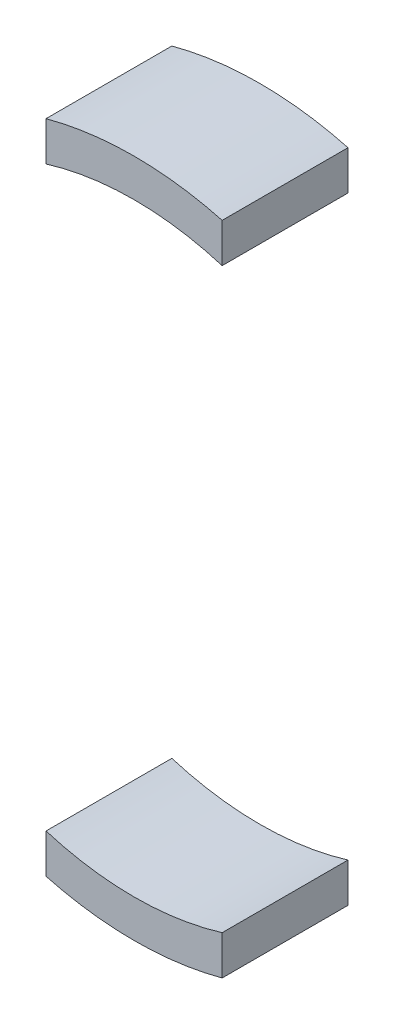
from build123d import *

# Parameters (mm, degrees)
BOSS_EXTRU_1_DEPTH   = 2.5
BOSS_EXTRU_1_2_DEPTH = 2.5


with BuildPart() as part:
    # Esquisse1 → Boss.-Extru.1 (new body)
    with BuildSketch(Plane.XY):
        with BuildLine():
            Line((1.75, 6.519202405), (1.75, 5.739120142))
            ThreePointArc((1.75, 5.739120142), (0, 6), (-1.75, 5.739120142))
            Line((-1.75, 5.739120142), (-1.75, 6.519202405))
            ThreePointArc((-1.75, 6.519202405), (0, 6.75), (1.75, 6.519202405))
        make_face()
    extrude(amount=BOSS_EXTRU_1_DEPTH)


with BuildPart() as body_2:
    # Esquisse1 → Boss.-Extru.1 2 (new body)
    with BuildSketch(Plane.XY):
        with BuildLine():
            Line((-1.75, -5.739120142), (-1.75, -6.519202405))
            ThreePointArc((-1.75, -6.519202405), (0, -6.75), (1.75, -6.519202405))
            Line((1.75, -6.519202405), (1.75, -5.739120142))
            ThreePointArc((1.75, -5.739120142), (0, -6), (-1.75, -5.739120142))
        make_face()
    extrude(amount=BOSS_EXTRU_1_2_DEPTH)


solid = Compound([part.part, body_2.part])
